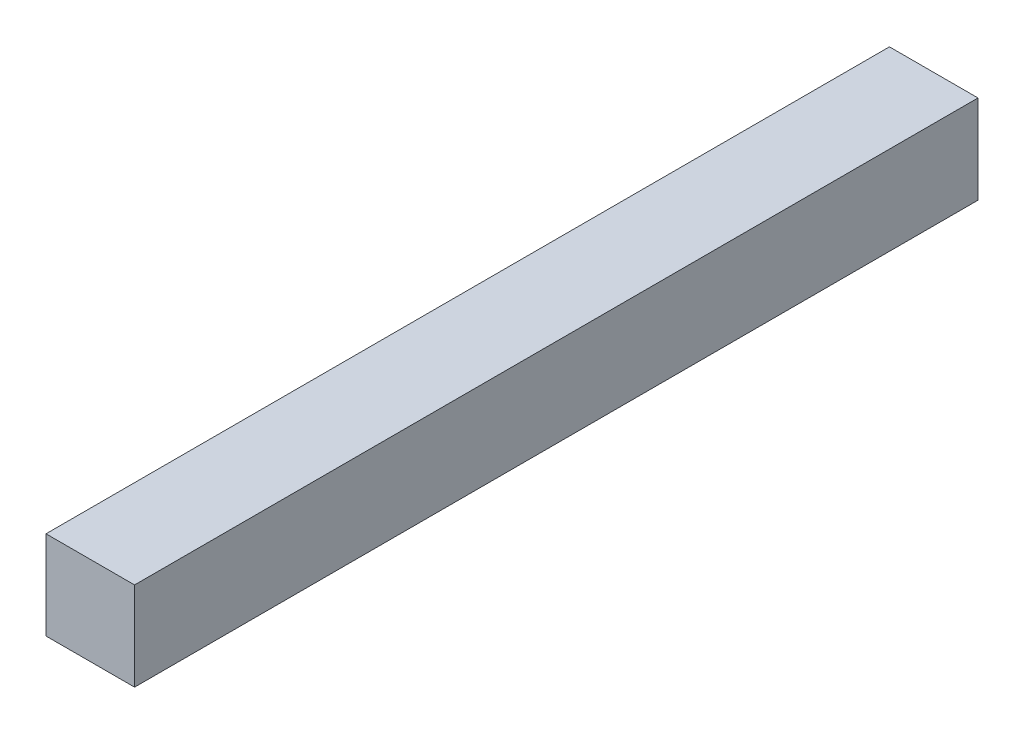
from build123d import *

# Parameters (mm, degrees)
SKETCH1_W           = 21
SKETCH1_H           = 21
BOSS_EXTRUDE1_DEPTH = 200


with BuildPart() as part:
    # Sketch1 → Boss-Extrude1 (new body)
    with BuildSketch(Plane.XY):
        Rectangle(SKETCH1_W, SKETCH1_H)
    extrude(amount=BOSS_EXTRUDE1_DEPTH)


solid = part.part
